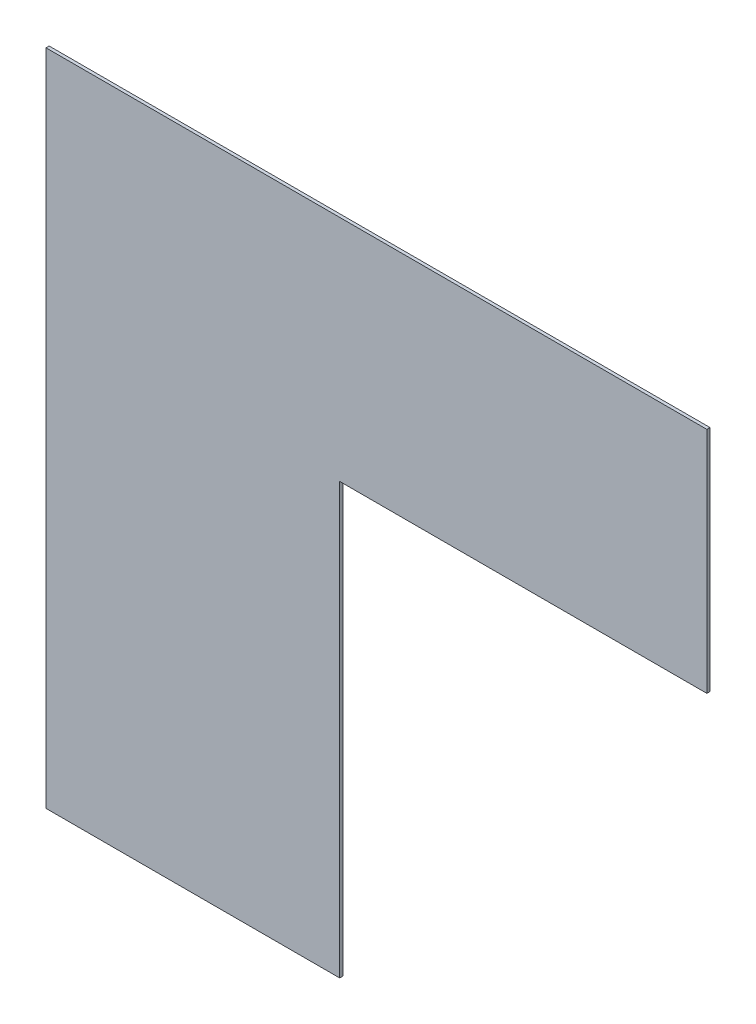
from build123d import *

# Parameters (mm, degrees)
BOSS_EXTRU_1_DEPTH = 3


with BuildPart() as part:
    # Esquisse1 → Boss.-Extru.1 (new body)
    with BuildSketch(Plane.XY):
        Polygon((350, 628), (-280, 628), (-280, 0), (0, 0), (0, 410), (350, 410), align=None)
    extrude(amount=BOSS_EXTRU_1_DEPTH)


solid = part.part
